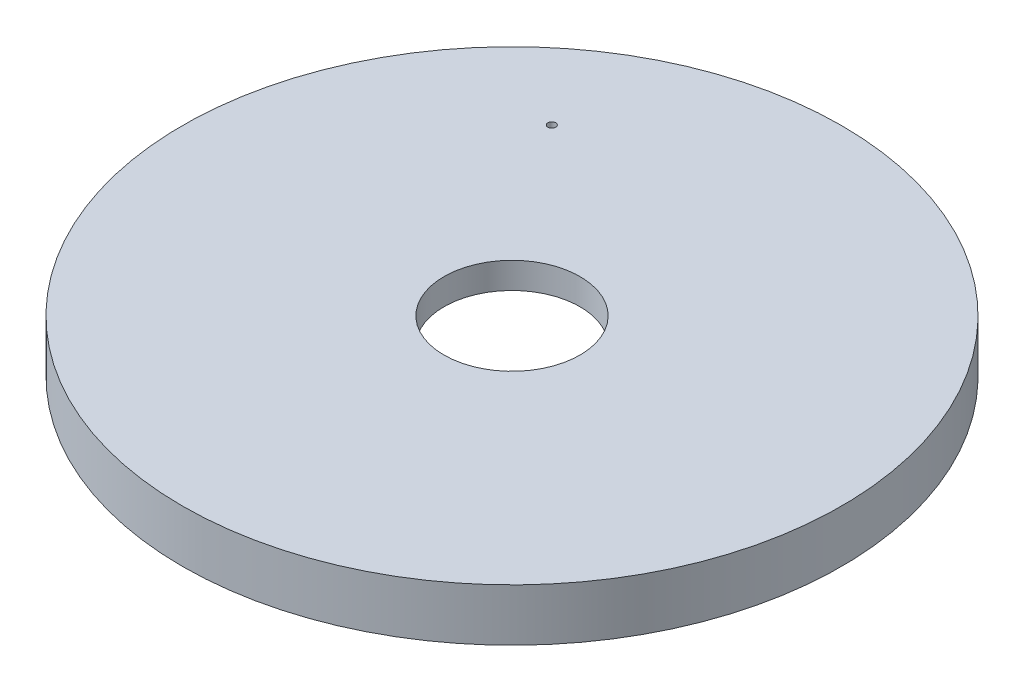
from build123d import *

# Parameters (mm, degrees)
SZKIC2_R                   = 0.75
WYTNIJ_WYCI_GNI_CIE2_DEPTH = 15


with BuildPart() as part:
    # Szkic1 → Obrót1 (revolve)
    with BuildSketch(Plane.XY, mode=Mode.PRIVATE) as obr_t1_sk:
        Polygon((13, 2.5), (63, 2.5), (63, -7.5), (31.660254038, -7.5), (13, -2.5), align=None)
    revolve(obr_t1_sk.sketch.rotate(Axis((0, 24.608336301, 0), (0, -1, 0)), 90), axis=Axis((0, 24.608336301, 0), (0, -1, 0)))

    # Szkic2 → Wytnij-wyciągnięcie2 (cut, symmetric)
    with BuildSketch(Plane(origin=(0, 0, 0), x_dir=(1, 0, 0), z_dir=(0, 1, 0))):
        with Locations(Location((-27.785960816, 35.396897909, 0), (0, 0, 270))):
            Circle(SZKIC2_R)
    extrude(amount=WYTNIJ_WYCI_GNI_CIE2_DEPTH, both=True, mode=Mode.SUBTRACT)


solid = part.part
